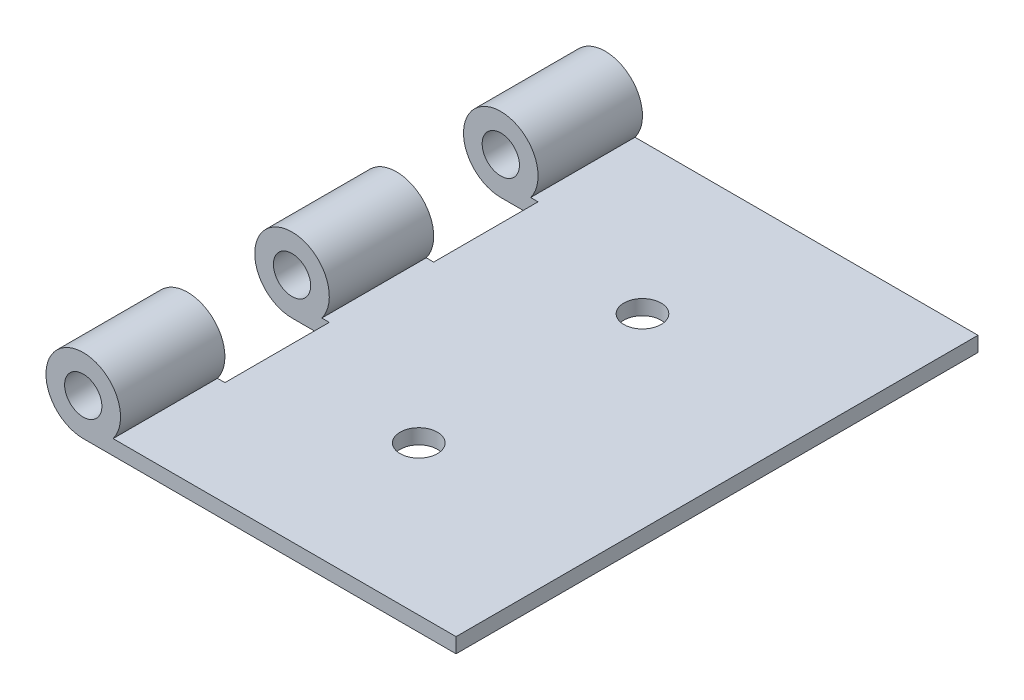
from build123d import *

# Parameters (mm, degrees)
SKETCH1_W               = 50
SKETCH1_H               = 70
BOSS_EXTRUDE1_DEPTH     = 2
SKETCH2_R               = 5
SKETCH2_R_2             = 2.5
BOSS_EXTRUDE2_DEPTH     = 70
SKETCH3_R               = 2.5
CUT_EXTRUDE1_DEPTH      = 47.786750261
CUT_EXTRUDE2_DEPTH      = 47.786750261
CUT_EXTRUDE2_DEPTH_BACK = 47.786750261
SKETCH5_W               = 10
SKETCH5_H               = 14


with BuildPart() as part:
    # Sketch1 → Boss-Extrude1 (new body)
    with BuildSketch(Plane(origin=(0, 0, 0), x_dir=(1, 0, 0), z_dir=(0, 1, 0))):
        Rectangle(SKETCH1_W, SKETCH1_H)
    extrude(amount=BOSS_EXTRUDE1_DEPTH)

    # Sketch2 → Boss-Extrude2 (add)
    with BuildSketch(Plane.XY.offset(35)):
        with Locations((-25, 5)):
            Circle(SKETCH2_R)
        with Locations((-25, 5)):
            Circle(SKETCH2_R_2, mode=Mode.SUBTRACT)
    extrude(amount=-BOSS_EXTRUDE2_DEPTH)

    # Sketch3 → Cut-Extrude1 (cut, through all)
    with BuildSketch(Plane(origin=(0, 2, 0), x_dir=(1, 0, 0), z_dir=(0, 1, 0))):
        with Locations(Location((0, 15, 0), (0, 0, 270))):
            Circle(SKETCH3_R)
        with Locations(Location((0, -15, 0), (0, 0, 270))):
            Circle(SKETCH3_R)
    extrude(amount=-CUT_EXTRUDE1_DEPTH, mode=Mode.SUBTRACT)

    # Sketch5 → Cut-Extrude2 (cut, two sides: drawn at the far end of the back side and taken through both)
    with BuildSketch(Plane(origin=(0, 2, 0), x_dir=(1, 0, 0), z_dir=(0, 1, 0)).offset(-CUT_EXTRUDE2_DEPTH_BACK)):
        with Locations((-25, -14)):
            Rectangle(SKETCH5_W, SKETCH5_H)
        with Locations((-25, 14)):
            Rectangle(SKETCH5_W, SKETCH5_H)
    extrude(amount=CUT_EXTRUDE2_DEPTH + CUT_EXTRUDE2_DEPTH_BACK, mode=Mode.SUBTRACT)


solid = part.part
